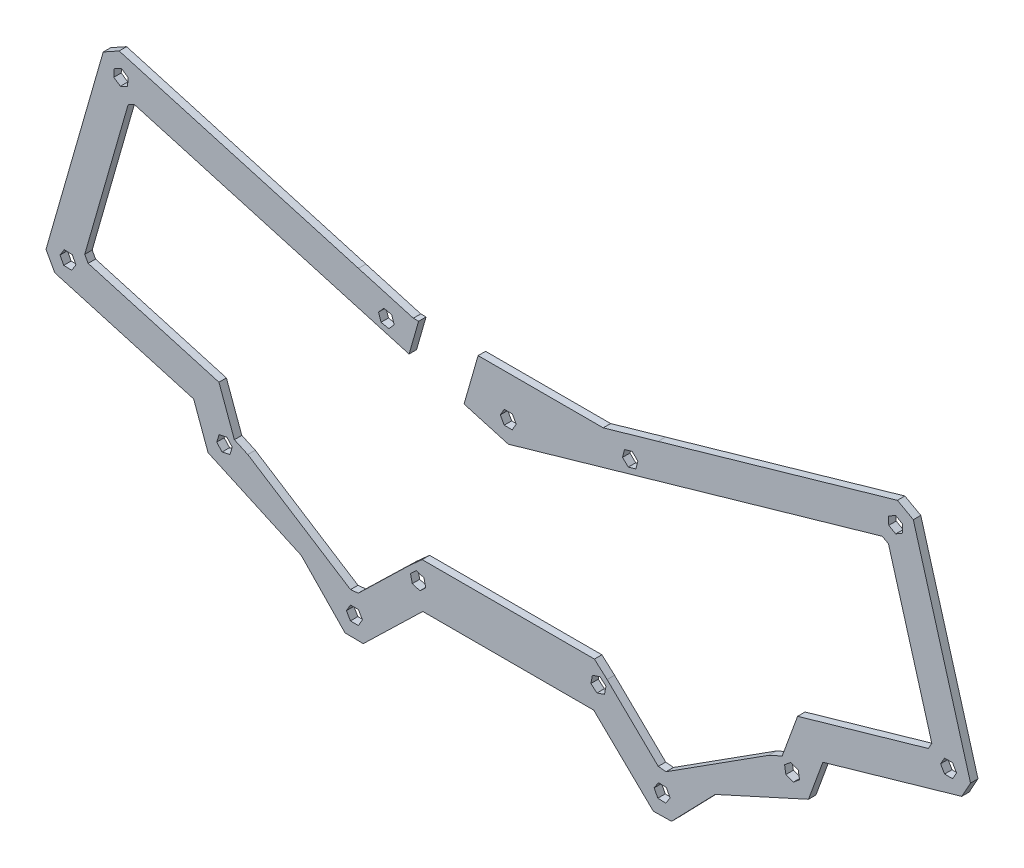
from build123d import *

# Parameters (mm, degrees)
BOSS_EXTRU_1_DEPTH = 3


with BuildPart() as part:
    # Esquisse1 → Boss.-Extru.1 (new body)
    with BuildSketch(Plane.XY):
        Polygon((-179.931816419, -11.401531345), (-180.017838024, -11.701531345), (-185.57619805, -31.086289447), (-167.791072806, -36.185021562), (-127.904950096, -24.747859919), (-17.351203316, 6.946262636), (-14.877374555, 5.574907028), (2.556514314, -55.224288823), (1.185265633, -57.698086926), (-51.424530344, -72.783703169), (-57.630729871, -89.716454796), (-63.024672228, -92.169507978), (-104.349665635, -118.563827288), (-107.470944884, -118.248029963), (-128.050089261, -98.290842938), (-133.151477342, -93.715936913), (-202.439042401, -93.715936913), (-207.540430482, -98.290842938), (-228.119574859, -118.248029963), (-231.240854108, -118.563827288), (-272.565847516, -92.169507978), (-277.959789872, -89.716454796), (-284.165989399, -72.783703169), (-336.775785376, -57.698086926), (-338.147034057, -55.224288823), (-320.713145188, 5.574907028), (-318.239316427, 6.946262636), (-207.685569647, -24.747859919), (-203.944682562, -11.701531345), (-203.858660957, -11.401531345), (-205.982988252, -11.401531345), (-221.327812729, -7.001473731), (-228.053301524, -5.072970852), (-324.305573392, 22.521130566), (-330.707501003, 18.97225141), (-353.72243999, -61.290379239), (-350.173829458, -67.692242105), (-294.328030452, -83.705767284), (-288.532091821, -99.519179156), (-251.042661762, -116.568594893), (-233.45174982, -134.735979634), (-226.135810249, -134.851076098), (-202.175390102, -111.650948678), (-133.415129641, -111.650948678), (-109.454709494, -134.851076098), (-102.138769923, -134.735979634), (-84.547857981, -116.568594893), (-47.058427922, -99.519179156), (-41.262489291, -83.705767284), (14.583309715, -67.692242105), (18.131920247, -61.290379239), (-4.88301874, 18.97225141), (-11.284946351, 22.521130566), (-107.537218219, -5.072970852), (-114.262707014, -7.001473731), (-123.876268292, -9.758118068), (-129.607531491, -11.401531345), (-167.175777529, -11.401531345), align=None)
        Polygon((-226.456549288, -126.726039887), (-228.072581173, -129.499661036), (-231.282623491, -129.486946945), (-232.876633924, -126.700611704), (-231.260602039, -123.926990555), (-228.050559721, -123.939704646), align=None, mode=Mode.SUBTRACT)
        Polygon((-201.720052379, -99.68218544), (-200.986265397, -102.807259839), (-203.325765724, -105.005275206), (-206.399053033, -104.078216174), (-207.132840016, -100.953141775), (-204.793339689, -98.755126408), align=None, mode=Mode.SUBTRACT)
        Polygon((-278.801584282, -92.701419409), (-279.761510176, -95.764600045), (-282.89426537, -96.464870154), (-285.067094671, -94.101959627), (-284.107168778, -91.03877899), (-280.974413583, -90.338508881), align=None, mode=Mode.SUBTRACT)
        Polygon((-341.674936445, -60.693756917), (-343.381773974, -63.412440235), (-346.589641557, -63.293617233), (-348.09067161, -60.456110913), (-346.38383408, -57.737427596), (-343.175966498, -57.856250598), align=None, mode=Mode.SUBTRACT)
        Polygon((-102.716844109, -126.851692582), (-104.440215275, -129.559925429), (-107.647299303, -129.421558643), (-109.131012166, -126.574959009), (-107.407640999, -123.866726161), (-104.200556971, -124.005092948), align=None, mode=Mode.SUBTRACT)
        Polygon((-129.102521286, -103.979530359), (-132.134816884, -105.032961295), (-134.563262635, -102.933631743), (-133.959412787, -99.780871255), (-130.927117189, -98.727440319), (-128.498671438, -100.826769871), align=None, mode=Mode.SUBTRACT)
        Polygon((-51.178552765, -91.36063702), (-50.649763202, -94.526851626), (-53.127390703, -96.567904124), (-56.133807767, -95.442742016), (-56.662597331, -92.27652741), (-54.18496983, -90.235474912), align=None, mode=Mode.SUBTRACT)
        Polygon((10.897318032, -57.794933915), (12.502351781, -60.574933915), (10.897318032, -63.354933915), (7.687250536, -63.354933915), (6.082216787, -60.574933915), (7.687250536, -57.794933915), align=None, mode=Mode.SUBTRACT)
        Polygon((-217.840116073, -13.876277124), (-214.696831686, -14.527657653), (-213.689301579, -17.575512049), (-215.825055858, -19.971985915), (-218.968340246, -19.320605385), (-219.975870353, -16.272750989), align=None, mode=Mode.SUBTRACT)
        Polygon((-326.25776259, 15.467139628), (-323.377643582, 16.884689567), (-320.709949819, 15.09920831), (-320.922375064, 11.896177113), (-323.802494072, 10.478627174), (-326.470187835, 12.264108431), align=None, mode=Mode.SUBTRACT)
        Polygon((-169.385770719, -24.817214521), (-166.175746894, -24.833958909), (-164.585236046, -27.622293282), (-166.204749024, -30.393883267), (-169.414772849, -30.37713888), (-171.005283697, -27.588804506), align=None, mode=Mode.SUBTRACT)
        Polygon((-117.981174931, -13.809459943), (-115.672169645, -16.039488624), (-116.448928491, -19.154160201), (-119.534692623, -20.038803095), (-121.84369791, -17.808774414), (-121.066939064, -14.694102838), align=None, mode=Mode.SUBTRACT)
        Polygon((-12.039253575, 16.891491339), (-9.240055353, 15.320178943), (-9.201252694, 12.110345974), (-11.961648258, 10.471825402), (-14.76084648, 12.043137798), (-14.799649138, 15.252970767), align=None, mode=Mode.SUBTRACT)
    extrude(amount=BOSS_EXTRU_1_DEPTH)


solid = part.part
